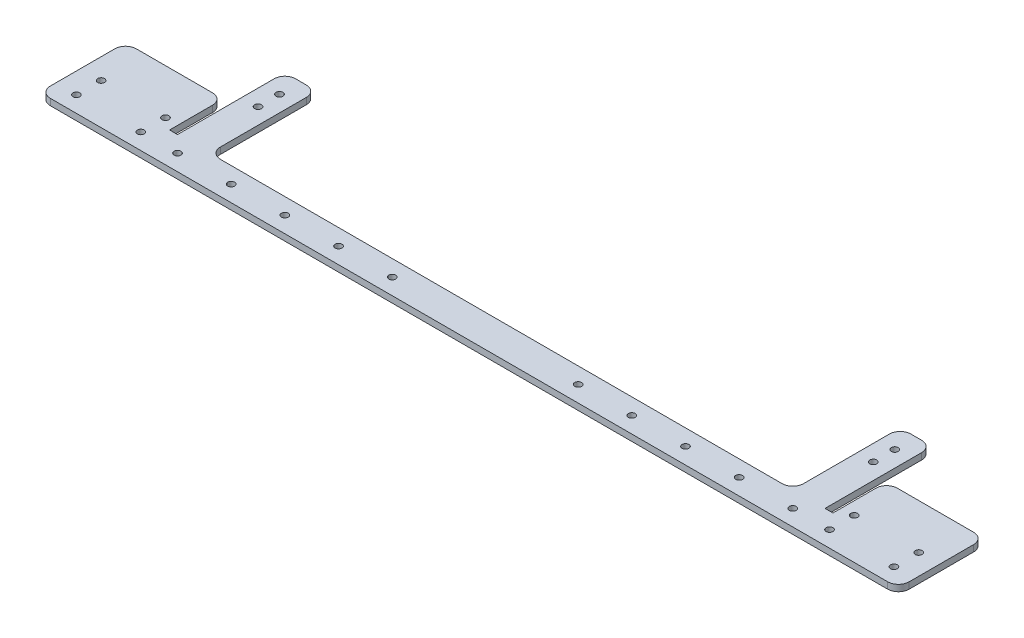
from build123d import *

# Parameters (mm, degrees)
SKETCH1_R           = 1.6
BOSS_EXTRUDE1_DEPTH = 3
FILLET1_R           = 5
SKETCH2_W           = 400
SKETCH2_H           = 15
CUT_EXTRUDE1_DEPTH  = 406.25794255
FILLET2_R           = 5
SKETCH3_W           = 45.5
SKETCH3_H           = 10
BOSS_EXTRUDE2_DEPTH = 3
FILLET3_R           = 5
SKETCH4_W           = 3.7
SKETCH4_H           = 15
CUT_EXTRUDE2_DEPTH  = 406.25794255


with BuildPart() as part:
    # Sketch1 → Boss-Extrude1 (new body)
    with BuildSketch(Plane(origin=(0, 0, 0), x_dir=(1, 0, 0), z_dir=(0, 1, 0))):
        Polygon((0, -15), (49.2, -15), (49.2, 0), (350.8, 0), (350.8, -15), (400, -15), (400, 30), (350.8, 30), (350.8, 65), (335.8, 65), (335.8, 15), (64.2, 15), (64.2, 65), (49.2, 65), (49.2, 30), (0, 30), align=None)
        with Locations(Location((9.6, 7.5, 0), (0, 0, 270))):
            Circle(SKETCH1_R, mode=Mode.SUBTRACT)
        with Locations(Location((39.6, 7.5, 0), (0, 0, 270))):
            Circle(SKETCH1_R, mode=Mode.SUBTRACT)
        with Locations(Location((39.6, -4, 0), (0, 0, 270))):
            Circle(SKETCH1_R, mode=Mode.SUBTRACT)
        with Locations(Location((9.6, -4, 0), (0, 0, 270))):
            Circle(SKETCH1_R, mode=Mode.SUBTRACT)
        with Locations(Location((343.3, 7.5, 0), (0, 0, 270))):
            Circle(SKETCH1_R, mode=Mode.SUBTRACT)
        with Locations(Location((56.7, 7.5, 0), (0, 0, 270))):
            Circle(SKETCH1_R, mode=Mode.SUBTRACT)
        with Locations(Location((81.7, 7.5, 0), (0, 0, 270))):
            Circle(SKETCH1_R, mode=Mode.SUBTRACT)
        with Locations(Location((106.7, 7.5, 0), (0, 0, 270))):
            Circle(SKETCH1_R, mode=Mode.SUBTRACT)
        with Locations(Location((131.7, 7.5, 0), (0, 0, 270))):
            Circle(SKETCH1_R, mode=Mode.SUBTRACT)
        with Locations(Location((156.7, 7.5, 0), (0, 0, 270))):
            Circle(SKETCH1_R, mode=Mode.SUBTRACT)
        with Locations(Location((243.3, 7.5, 0), (0, 0, 270))):
            Circle(SKETCH1_R, mode=Mode.SUBTRACT)
        with Locations(Location((268.3, 7.5, 0), (0, 0, 270))):
            Circle(SKETCH1_R, mode=Mode.SUBTRACT)
        with Locations(Location((293.3, 7.5, 0), (0, 0, 270))):
            Circle(SKETCH1_R, mode=Mode.SUBTRACT)
        with Locations(Location((318.3, 7.5, 0), (0, 0, 270))):
            Circle(SKETCH1_R, mode=Mode.SUBTRACT)
        with Locations(Location((39.6, 19, 0), (0, 0, 270))):
            Circle(SKETCH1_R, mode=Mode.SUBTRACT)
        with Locations(Location((9.6, 19, 0), (0, 0, 270))):
            Circle(SKETCH1_R, mode=Mode.SUBTRACT)
        with Locations(Location((390.4, 7.5, 0), (0, 0, 270))):
            Circle(SKETCH1_R, mode=Mode.SUBTRACT)
        with Locations(Location((360.4, 7.5, 0), (0, 0, 270))):
            Circle(SKETCH1_R, mode=Mode.SUBTRACT)
        with Locations(Location((390.4, -4, 0), (0, 0, 270))):
            Circle(SKETCH1_R, mode=Mode.SUBTRACT)
        with Locations(Location((360.4, -4, 0), (0, 0, 270))):
            Circle(SKETCH1_R, mode=Mode.SUBTRACT)
        with Locations(Location((56.7, 45, 0), (0, 0, 270))):
            Circle(SKETCH1_R, mode=Mode.SUBTRACT)
        with Locations(Location((56.7, 55, 0), (0, 0, 270))):
            Circle(SKETCH1_R, mode=Mode.SUBTRACT)
        with Locations(Location((390.4, 19, 0), (0, 0, 270))):
            Circle(SKETCH1_R, mode=Mode.SUBTRACT)
        with Locations(Location((360.4, 19, 0), (0, 0, 270))):
            Circle(SKETCH1_R, mode=Mode.SUBTRACT)
        with Locations(Location((343.3, 45, 0), (0, 0, 270))):
            Circle(SKETCH1_R, mode=Mode.SUBTRACT)
        with Locations(Location((343.3, 55, 0), (0, 0, 270))):
            Circle(SKETCH1_R, mode=Mode.SUBTRACT)
    extrude(amount=BOSS_EXTRUDE1_DEPTH)

    # Fillet1
    fillet1_edges = [part.edges().sort_by_distance(p)[0] for p in [
        (400, 1.5, 15),
        (350.8, 1.5, 15),
        (49.2, 1.5, 15),
        (0, 1.5, 15),
        (49.2, 1.5, -65),
        (64.2, 1.5, -65),
        (64.2, 1.5, -15),
        (335.8, 1.5, -15),
        (335.8, 1.5, -65),
        (350.8, 1.5, -65),
    ]]
    fillet(fillet1_edges, radius=FILLET1_R)

    # Sketch2 → Cut-Extrude1 (cut, through all)
    with BuildSketch(Plane(origin=(0, 3, 0), x_dir=(1, 0, 0), z_dir=(0, 1, 0))):
        with Locations((200, -7.5)):
            Rectangle(SKETCH2_W, SKETCH2_H)
    extrude(amount=-CUT_EXTRUDE1_DEPTH, mode=Mode.SUBTRACT)

    # Fillet2
    fillet2_edges = [part.edges().sort_by_distance(p)[0] for p in [
        (0, 1.5, 0),
        (400, 1.5, 0),
    ]]
    fillet(fillet2_edges, radius=FILLET2_R)

    # Sketch3 → Boss-Extrude2 (add)
    with BuildSketch(Plane.XZ):
        with Locations((377.25, -35)):
            Rectangle(SKETCH3_W, SKETCH3_H)
        with Locations((22.75, -35)):
            Rectangle(SKETCH3_W, SKETCH3_H)
    extrude(amount=-BOSS_EXTRUDE2_DEPTH)

    # Fillet3
    fillet3_edges = [part.edges().sort_by_distance(p)[0] for p in [
        (400, 1.5, -40),
        (354.5, 1.5, -40),
        (0, 1.5, -40),
        (45.5, 1.5, -40),
    ]]
    fillet(fillet3_edges, radius=FILLET3_R)

    # Sketch4 → Cut-Extrude2 (cut, through all)
    with BuildSketch(Plane(origin=(0, 3, 0), x_dir=(1, 0, 0), z_dir=(0, 1, 0))):
        with Locations((352.65, 22.5)):
            Rectangle(SKETCH4_W, SKETCH4_H)
        with Locations((47.35, 22.5)):
            Rectangle(SKETCH4_W, SKETCH4_H)
    extrude(amount=-CUT_EXTRUDE2_DEPTH, mode=Mode.SUBTRACT)


solid = part.part
